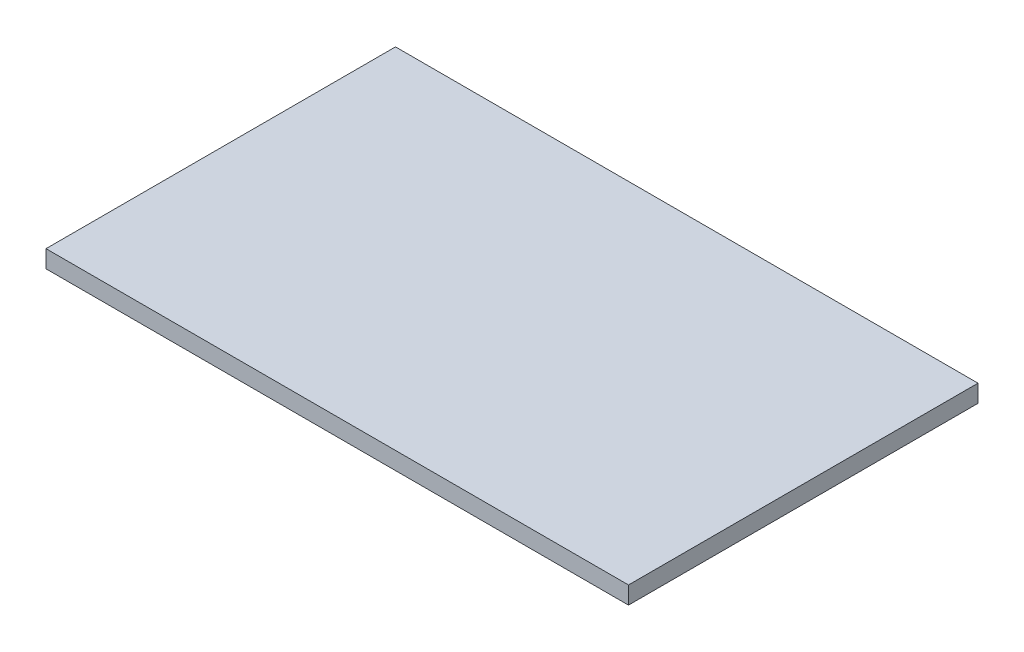
from build123d import *

# Parameters (mm, degrees)
SKETCH1_W           = 100
SKETCH1_H           = 60
BOSS_EXTRUDE1_DEPTH = 3


with BuildPart() as part:
    # Sketch1 → Boss-Extrude1 (new body)
    with BuildSketch(Plane(origin=(0, 0, 0), x_dir=(1, 0, 0), z_dir=(0, 1, 0))):
        with Locations((50, 30)):
            Rectangle(SKETCH1_W, SKETCH1_H)
    extrude(amount=BOSS_EXTRUDE1_DEPTH)


solid = part.part
